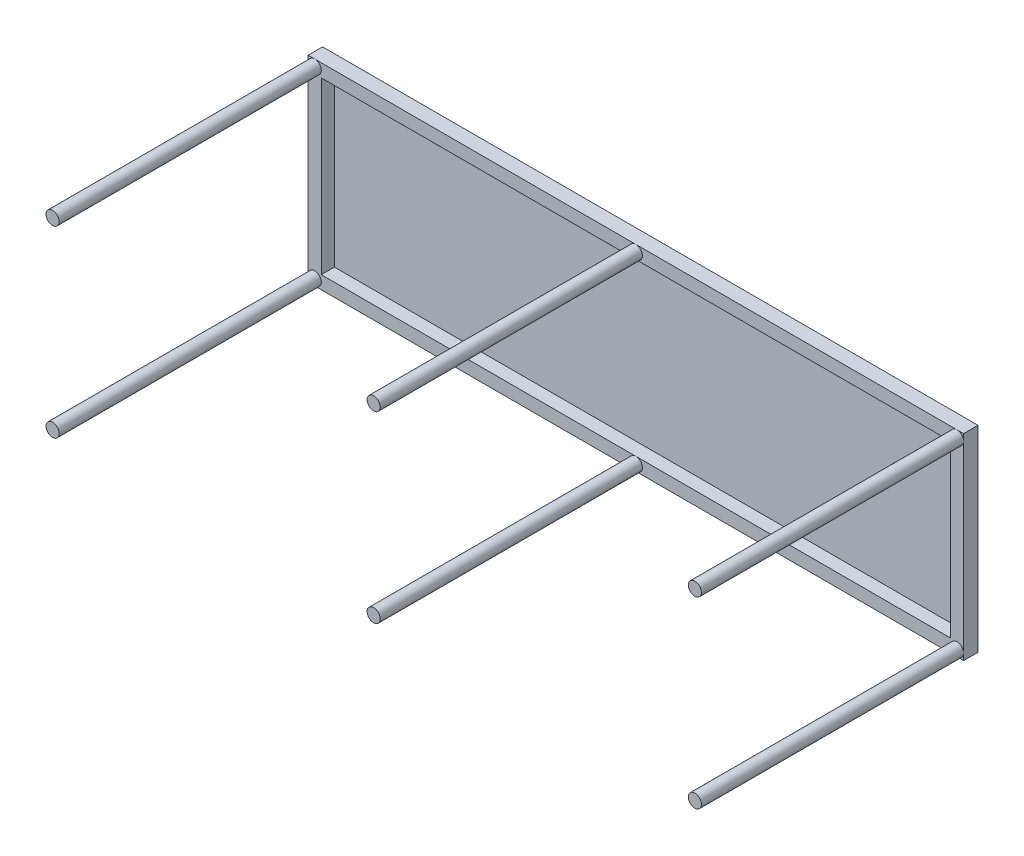
from build123d import *

# Parameters (mm, degrees)
SKETCH_1_W      = 5000
SKETCH_1_H      = 1500
EXTRUDE_1_DEPTH = 10
SKETCH_2_W      = 5000
SKETCH_2_H      = 1500
SKETCH_2_W_2    = 4800
SKETCH_2_H_2    = 1300
EXTRUDE_2_DEPTH = 100
SKETCH_3_R      = 50
EXTRUDE_3_DEPTH = 2000
SKETCH_4_R      = 50
EXTRUDE_4_DEPTH = 2000


with BuildPart() as part:
    # 草图1 → 凸台-拉伸1 (new body)
    with BuildSketch(Plane.XY):
        with Locations((2440.963587986, -722.784179357)):
            Rectangle(SKETCH_1_W, SKETCH_1_H)
    extrude(amount=EXTRUDE_1_DEPTH)

    # 草图2 → 凸台-拉伸2 (add)
    with BuildSketch(Plane.XY.offset(10)):
        with Locations((2440.963587986, -722.784179357)):
            Rectangle(SKETCH_2_W, SKETCH_2_H)
        with Locations((2440.963587986, -722.784179357)):
            Rectangle(SKETCH_2_W_2, SKETCH_2_H_2, mode=Mode.SUBTRACT)
    extrude(amount=EXTRUDE_2_DEPTH)

    # 草图3 → 凸台-拉伸3 (add)
    with BuildSketch(Plane.XY.offset(110)):
        with Locations(Location((-9.036412014, -22.784179357, 0), (0, 0, 180))):
            Circle(SKETCH_3_R)
        with Locations(Location((-9.036412014, -1422.784179357, 0), (0, 0, 180))):
            Circle(SKETCH_3_R)
        with Locations((4890.963587986, -1422.784179357)):
            Circle(SKETCH_3_R)
        with Locations((4890.963587986, -22.784179357)):
            Circle(SKETCH_3_R)
    extrude(amount=EXTRUDE_3_DEPTH)

    # 草图4 → 凸台-拉伸4 (add)
    with BuildSketch(Plane.XY.offset(110)):
        with Locations(Location((2440.963587986, -22.784179357, 0), (0, 0, 270))):
            Circle(SKETCH_4_R)
        with Locations(Location((2440.963587986, -1422.784179357, 0), (0, 0, 270))):
            Circle(SKETCH_4_R)
    extrude(amount=EXTRUDE_4_DEPTH)


solid = part.part
